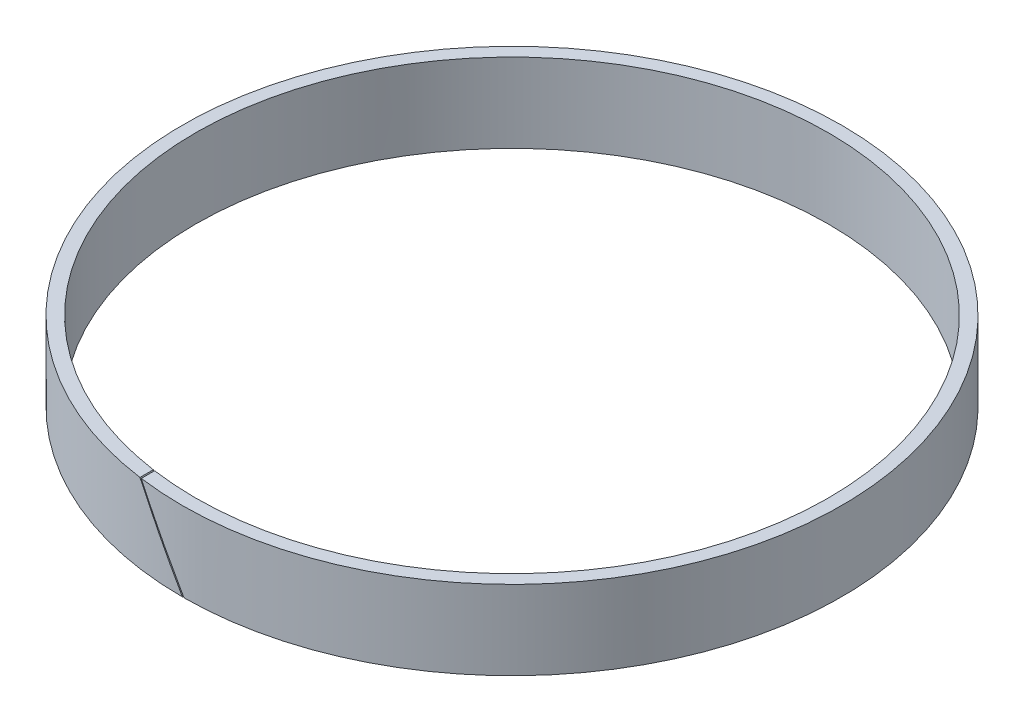
from build123d import *

# Parameters (mm, degrees)
SKETCH1_R           = 25
SKETCH1_R_2         = 24
BOSS_EXTRUDE1_DEPTH = 6
CUT_EXTRUDE1_REACH  = 37.861


with BuildPart() as part:
    # Sketch1 → Boss-Extrude1 (new body)
    with BuildSketch(Plane(origin=(0, 0, 0), x_dir=(1, 0, 0), z_dir=(0, 1, 0))):
        with Locations(Location((0, 0, 0), (0, 0, 270))):
            Circle(SKETCH1_R)
        with Locations(Location((0, 0, 0), (0, 0, 270))):
            Circle(SKETCH1_R_2, mode=Mode.SUBTRACT)
    extrude(amount=BOSS_EXTRUDE1_DEPTH)

    # Sketch2 → Cut-Extrude1 (cut, up to next)
    with BuildSketch(Plane.XY, mode=Mode.PRIVATE) as cut_extrude1_sk1:
        Polygon((0, 0), (-3.464101615, 6), (-3.348631561, 6), (0.115470054, 0), align=None)
    cut_extrude1_tool1 = extrude(cut_extrude1_sk1.sketch, amount=CUT_EXTRUDE1_REACH, mode=Mode.PRIVATE) & part.part
    add(cut_extrude1_tool1.solids().sort_by_distance((-1.674316, 3, 0))[0], mode=Mode.SUBTRACT)


solid = part.part
